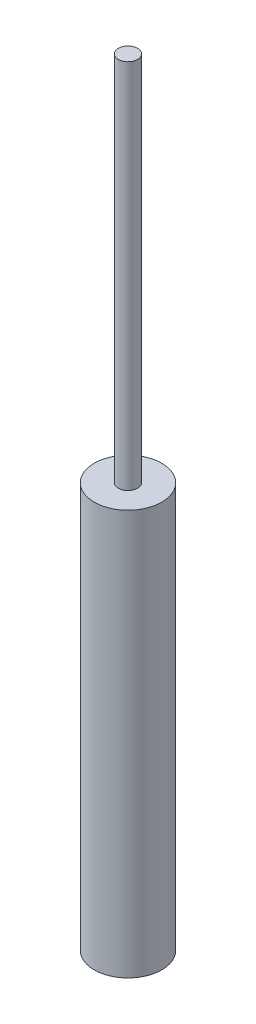
from build123d import *

# Parameters (mm, degrees)
SKETCH1_R           = 2.5
BOSS_EXTRUDE1_DEPTH = 15
SKETCH2_R           = 0.715
BOSS_EXTRUDE2_DEPTH = 27.5


with BuildPart() as part:
    # Sketch1 → Boss-Extrude1 (new, symmetric)
    with BuildSketch(Plane(origin=(0, 0, 0), x_dir=(1, 0, 0), z_dir=(0, 1, 0))):
        with Locations(Location((0, 0, 0), (0, 0, 270))):
            Circle(SKETCH1_R)
    extrude(amount=BOSS_EXTRUDE1_DEPTH, both=True)

    # Sketch2 → Boss-Extrude2 (add)
    with BuildSketch(Plane(origin=(0, 15, 0), x_dir=(1, 0, 0), z_dir=(0, 1, 0))):
        with Locations(Location((0, 0, 0), (0, 0, 270))):
            Circle(SKETCH2_R)
    extrude(amount=BOSS_EXTRUDE2_DEPTH)


solid = part.part
